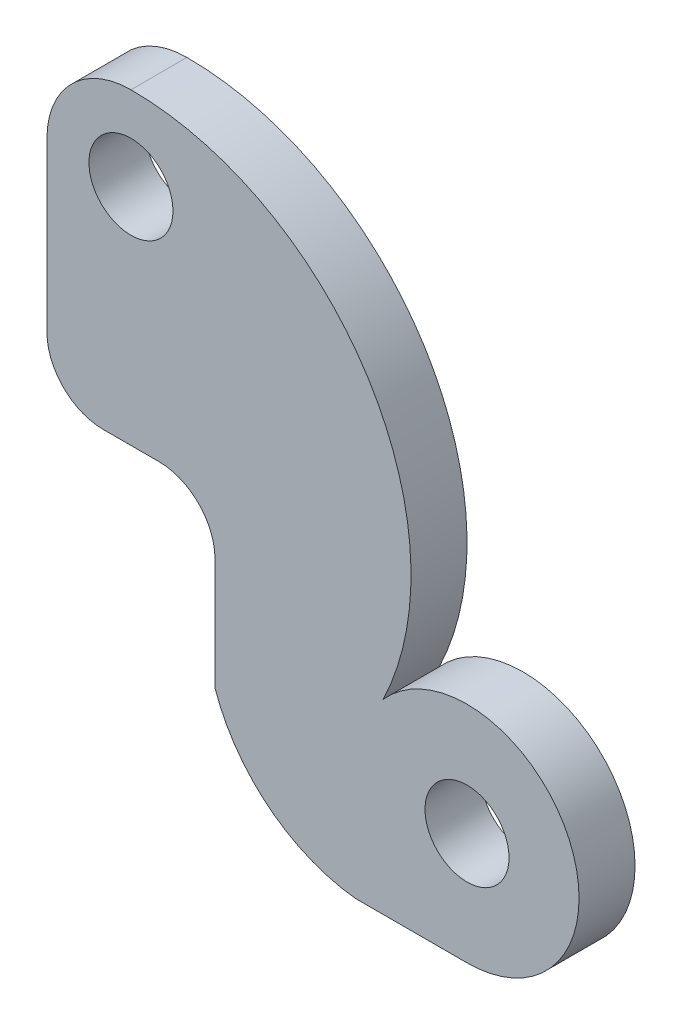
from build123d import *

# Parameters (mm, degrees)
SKETCH1_R           = 7.5
BOSS_EXTRUDE1_DEPTH = 5


with BuildPart() as part:
    # Sketch1 → Boss-Extrude1 (new, symmetric)
    with BuildSketch(Plane.XY):
        with BuildLine():
            Line((-15, 0), (-15, -30))
            ThreePointArc((-15, -30), (-12.071067812, -37.071067812), (-5, -40))
            Line((-5, -40), (5, -40))
            ThreePointArc((5, -40), (12.071067812, -42.928932188), (15, -50))
            Line((15, -50), (15, -70))
            ThreePointArc((15, -70), (24.609054321, -83.613682099), (40, -90))
            Line((40, -90), (60, -90))
            ThreePointArc((60, -90), (78.236466389, -61.788344037), (45.024841203, -56.743129366))
            ThreePointArc((45.024841203, -56.743129366), (42.350658013, -8.42140399), (0, 15))
            ThreePointArc((0, 15), (-10.606601718, 10.606601718), (-15, 0))
        make_face()
        Circle(SKETCH1_R, mode=Mode.SUBTRACT)
        with Locations((60, -70)):
            Circle(SKETCH1_R, mode=Mode.SUBTRACT)
    extrude(amount=BOSS_EXTRUDE1_DEPTH, both=True)


solid = part.part
